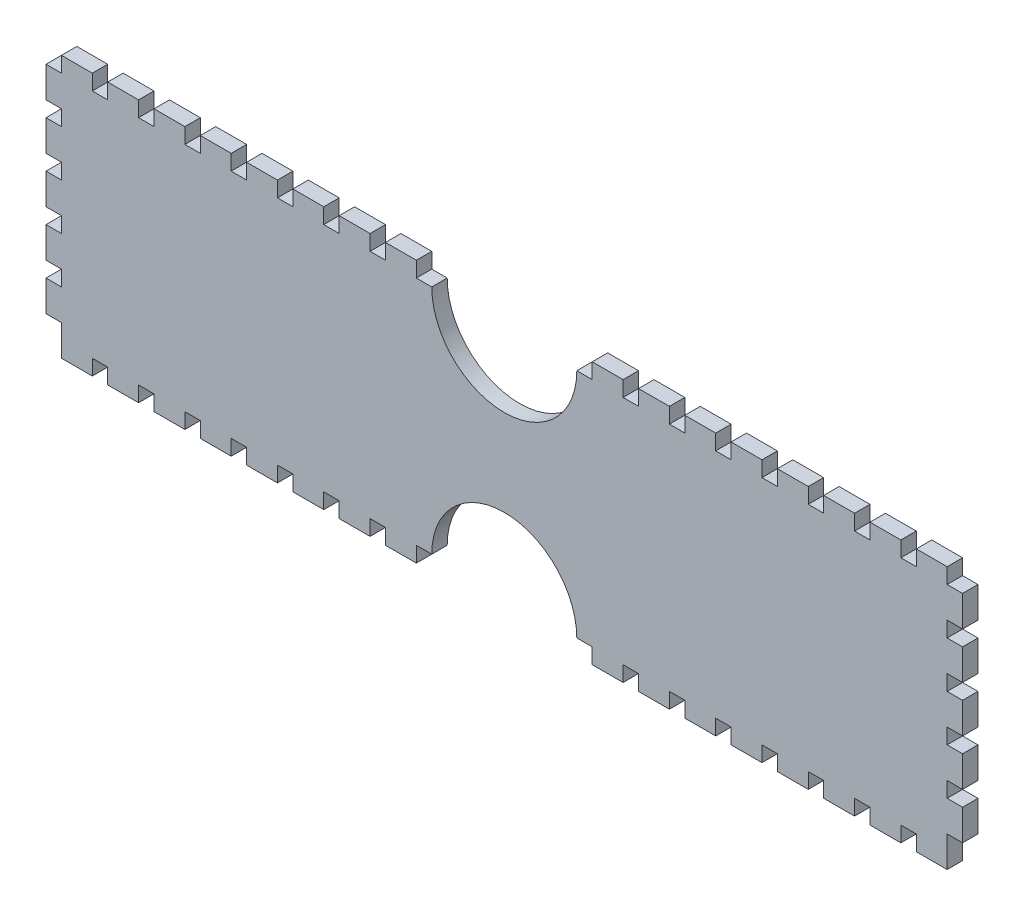
from build123d import *

# Parameters (mm, degrees)
ESQUISSE1_W                = 297
ESQUISSE1_H                = 85
BOSS_EXTRU_1_DEPTH         = 5
ENL_V_MAT_EXTRU_2_REACH    = 179.089
ESQUISSE4_W                = 5
ESQUISSE4_H                = 5
R_P_TITION_LIN_AIRE1_COUNT = 6
R_P_TITION_LIN_AIRE1_PITCH = 15
ESQUISSE5_W                = 5
ESQUISSE5_H                = 5
ENL_V_MAT_EXTRU_3_DEPTH    = 5
ESQUISSE6_W                = 5
ESQUISSE6_H                = 5
ENL_V_MAT_EXTRU_4_DEPTH    = 5
R_P_TITION_LIN_AIRE5_COUNT = 6
R_P_TITION_LIN_AIRE5_PITCH = 15
ESQUISSE8_W                = 5
ESQUISSE8_H                = 5
ENL_V_MAT_EXTRU_5_DEPTH    = 5
ESQUISSE9_W                = 5
ESQUISSE9_H                = 5
ENL_V_MAT_EXTRU_6_DEPTH    = 5
R_P_TITION_LIN_AIRE7_COUNT = 8
R_P_TITION_LIN_AIRE7_PITCH = 15
SYM_TRIE5_COPY_1_SKETCH_W  = 5
SYM_TRIE5_COPY_1_SKETCH_H  = 5
SYM_TRIE5_COPY_1_DEPTH     = 5
SYM_TRIE5_COPY_2_SKETCH_W  = 5
SYM_TRIE5_COPY_2_SKETCH_H  = 5
SYM_TRIE5_COPY_2_DEPTH     = 5
SYM_TRIE5_COPY_3_SKETCH_W  = 5
SYM_TRIE5_COPY_3_SKETCH_H  = 5
SYM_TRIE5_COPY_3_DEPTH     = 5
SYM_TRIE5_COPY_4_SKETCH_W  = 5
SYM_TRIE5_COPY_4_SKETCH_H  = 5
SYM_TRIE5_COPY_4_DEPTH     = 5
SYM_TRIE5_COPY_5_SKETCH_W  = 5
SYM_TRIE5_COPY_5_SKETCH_H  = 5
SYM_TRIE5_COPY_5_DEPTH     = 5
SYM_TRIE5_COPY_6_SKETCH_W  = 5
SYM_TRIE5_COPY_6_SKETCH_H  = 5
SYM_TRIE5_COPY_6_DEPTH     = 5
SYM_TRIE5_COPY_7_SKETCH_W  = 5
SYM_TRIE5_COPY_7_SKETCH_H  = 5
SYM_TRIE5_COPY_7_DEPTH     = 5
ESQUISSE11_W               = 47
ESQUISSE11_H               = 5
ENL_V_MAT_EXTRU_7_DEPTH    = 5
ESQUISSE12_W               = 47
ESQUISSE12_H               = 48.712218394
ENL_V_MAT_EXTRU_8_DEPTH    = 10
SYM_TRIE6_COPY_1_SKETCH_W  = 5
SYM_TRIE6_COPY_1_SKETCH_H  = 5
SYM_TRIE6_COPY_1_DEPTH     = 5
SYM_TRIE6_COPY_2_SKETCH_W  = 5
SYM_TRIE6_COPY_2_SKETCH_H  = 5
SYM_TRIE6_COPY_2_DEPTH     = 5
SYM_TRIE6_COPY_3_SKETCH_W  = 5
SYM_TRIE6_COPY_3_SKETCH_H  = 5
SYM_TRIE6_COPY_3_DEPTH     = 5
SYM_TRIE6_COPY_4_SKETCH_W  = 5
SYM_TRIE6_COPY_4_SKETCH_H  = 5
SYM_TRIE6_COPY_4_DEPTH     = 5
SYM_TRIE6_COPY_5_SKETCH_W  = 5
SYM_TRIE6_COPY_5_SKETCH_H  = 5
SYM_TRIE6_COPY_5_DEPTH     = 5
SYM_TRIE6_COPY_6_SKETCH_W  = 5
SYM_TRIE6_COPY_6_SKETCH_H  = 5
SYM_TRIE6_COPY_6_DEPTH     = 5
SYM_TRIE6_COPY_7_SKETCH_W  = 5
SYM_TRIE6_COPY_7_SKETCH_H  = 5
SYM_TRIE6_COPY_7_DEPTH     = 5
SYM_TRIE6_COPY_8_SKETCH_W  = 5
SYM_TRIE6_COPY_8_SKETCH_H  = 5
SYM_TRIE6_COPY_8_DEPTH     = 5
SYM_TRIE6_COPY_9_SKETCH_W  = 5
SYM_TRIE6_COPY_9_SKETCH_H  = 5
SYM_TRIE6_COPY_9_DEPTH     = 5
SYM_TRIE6_COPY_10_SKETCH_W = 5
SYM_TRIE6_COPY_10_SKETCH_H = 5
SYM_TRIE6_COPY_10_DEPTH    = 5
SYM_TRIE6_COPY_11_SKETCH_W = 5
SYM_TRIE6_COPY_11_SKETCH_H = 5
SYM_TRIE6_COPY_11_DEPTH    = 5
SYM_TRIE6_COPY_12_SKETCH_W = 5
SYM_TRIE6_COPY_12_SKETCH_H = 5
SYM_TRIE6_COPY_12_DEPTH    = 5
SYM_TRIE6_COPY_13_SKETCH_W = 5
SYM_TRIE6_COPY_13_SKETCH_H = 5
SYM_TRIE6_COPY_13_DEPTH    = 5
SYM_TRIE6_COPY_14_SKETCH_W = 5
SYM_TRIE6_COPY_14_SKETCH_H = 5
SYM_TRIE6_COPY_14_DEPTH    = 5
SYM_TRIE6_COPY_15_SKETCH_W = 5
SYM_TRIE6_COPY_15_SKETCH_H = 5
SYM_TRIE6_COPY_15_DEPTH    = 5


with BuildPart() as part:
    # Esquisse1 → Boss.-Extru.1 (new body)
    with BuildSketch(Plane.XY):
        with Locations((-16.405729948, 21.856109197)):
            Rectangle(ESQUISSE1_W, ESQUISSE1_H)
    extrude(amount=BOSS_EXTRU_1_DEPTH)

    # Esquisse4 → Enlèv. mat.-Extru.2 (cut, up to next)
    with BuildSketch(Plane.XY.offset(5), mode=Mode.PRIVATE) as enl_v_mat_extru_2_sk1:
        with Locations((-162.405729948, 61.856109197)):
            Rectangle(ESQUISSE4_W, ESQUISSE4_H)
    enl_v_mat_extru_2_tool1 = extrude(enl_v_mat_extru_2_sk1.sketch, amount=-ENL_V_MAT_EXTRU_2_REACH, mode=Mode.PRIVATE) & part.part
    enl_v_mat_extru_2 = enl_v_mat_extru_2_tool1.solids().sort_by_distance((-162.40573, 61.856109, 5))[0]
    add(enl_v_mat_extru_2, mode=Mode.SUBTRACT)

    # Répétition linéaire1: Enlèv. mat.-Extru.2 ×6
    with Locations(*[(0, -i * R_P_TITION_LIN_AIRE1_PITCH, 0) for i in range(1, R_P_TITION_LIN_AIRE1_COUNT)]):
        add(enl_v_mat_extru_2, mode=Mode.SUBTRACT)

    # Esquisse5 → Enlèv. mat.-Extru.3 (cut)
    with BuildSketch(Plane.XY.offset(5)):
        with Locations((-162.405729948, -18.143890803)):
            Rectangle(ESQUISSE5_W, ESQUISSE5_H)
    extrude(amount=-ENL_V_MAT_EXTRU_3_DEPTH, mode=Mode.SUBTRACT)

    # Esquisse6 → Enlèv. mat.-Extru.4 (cut)
    with BuildSketch(Plane.XY.offset(5)):
        with Locations((129.594270052, 61.856109197)):
            Rectangle(ESQUISSE6_W, ESQUISSE6_H)
    enl_v_mat_extru_4 = extrude(amount=-ENL_V_MAT_EXTRU_4_DEPTH, mode=Mode.SUBTRACT)

    # Répétition linéaire5: Enlèv. mat.-Extru.4 ×6
    with Locations(*[(0, -i * R_P_TITION_LIN_AIRE5_PITCH, 0) for i in range(1, R_P_TITION_LIN_AIRE5_COUNT)]):
        add(enl_v_mat_extru_4, mode=Mode.SUBTRACT)

    # Esquisse8 → Enlèv. mat.-Extru.5 (cut)
    with BuildSketch(Plane.XY.offset(5)):
        with Locations((129.594270052, -18.143890803)):
            Rectangle(ESQUISSE8_W, ESQUISSE8_H)
    extrude(amount=-ENL_V_MAT_EXTRU_5_DEPTH, mode=Mode.SUBTRACT)

    # Esquisse9 → Enlèv. mat.-Extru.6 (cut)
    with BuildSketch(Plane.XY.offset(5)):
        with Locations((-147.405729948, -18.143890803)):
            Rectangle(ESQUISSE9_W, ESQUISSE9_H)
    enl_v_mat_extru_6 = extrude(amount=-ENL_V_MAT_EXTRU_6_DEPTH, mode=Mode.SUBTRACT)

    # Répétition linéaire7: Enlèv. mat.-Extru.6 ×8
    with Locations(*[(i * R_P_TITION_LIN_AIRE7_PITCH, 0, 0) for i in range(1, R_P_TITION_LIN_AIRE7_COUNT)]):
        add(enl_v_mat_extru_6, mode=Mode.SUBTRACT)

    # Symétrie5: Enlèv. mat.-Extru.6 across plane
    add(enl_v_mat_extru_6.mirror(Plane.ZY.offset(16.405729948)), mode=Mode.SUBTRACT)

    # Symétrie5 copy 1 sketch → Symétrie5 copy 1 (cut)
    with BuildSketch(Plane(origin=(-47.811459896, 0, 5), x_dir=(-1, 0, 0), z_dir=(0, 0, 1))):
        with Locations((-147.405729948, 18.143890803)):
            Rectangle(SYM_TRIE5_COPY_1_SKETCH_W, SYM_TRIE5_COPY_1_SKETCH_H)
    extrude(amount=-SYM_TRIE5_COPY_1_DEPTH, mode=Mode.SUBTRACT)

    # Symétrie5 copy 2 sketch → Symétrie5 copy 2 (cut)
    with BuildSketch(Plane(origin=(-62.811459896, 0, 5), x_dir=(-1, 0, 0), z_dir=(0, 0, 1))):
        with Locations((-147.405729948, 18.143890803)):
            Rectangle(SYM_TRIE5_COPY_2_SKETCH_W, SYM_TRIE5_COPY_2_SKETCH_H)
    extrude(amount=-SYM_TRIE5_COPY_2_DEPTH, mode=Mode.SUBTRACT)

    # Symétrie5 copy 3 sketch → Symétrie5 copy 3 (cut)
    with BuildSketch(Plane(origin=(-77.811459896, 0, 5), x_dir=(-1, 0, 0), z_dir=(0, 0, 1))):
        with Locations((-147.405729948, 18.143890803)):
            Rectangle(SYM_TRIE5_COPY_3_SKETCH_W, SYM_TRIE5_COPY_3_SKETCH_H)
    extrude(amount=-SYM_TRIE5_COPY_3_DEPTH, mode=Mode.SUBTRACT)

    # Symétrie5 copy 4 sketch → Symétrie5 copy 4 (cut)
    with BuildSketch(Plane(origin=(-92.811459896, 0, 5), x_dir=(-1, 0, 0), z_dir=(0, 0, 1))):
        with Locations((-147.405729948, 18.143890803)):
            Rectangle(SYM_TRIE5_COPY_4_SKETCH_W, SYM_TRIE5_COPY_4_SKETCH_H)
    extrude(amount=-SYM_TRIE5_COPY_4_DEPTH, mode=Mode.SUBTRACT)

    # Symétrie5 copy 5 sketch → Symétrie5 copy 5 (cut)
    with BuildSketch(Plane(origin=(-107.811459896, 0, 5), x_dir=(-1, 0, 0), z_dir=(0, 0, 1))):
        with Locations((-147.405729948, 18.143890803)):
            Rectangle(SYM_TRIE5_COPY_5_SKETCH_W, SYM_TRIE5_COPY_5_SKETCH_H)
    extrude(amount=-SYM_TRIE5_COPY_5_DEPTH, mode=Mode.SUBTRACT)

    # Symétrie5 copy 6 sketch → Symétrie5 copy 6 (cut)
    with BuildSketch(Plane(origin=(-122.811459896, 0, 5), x_dir=(-1, 0, 0), z_dir=(0, 0, 1))):
        with Locations((-147.405729948, 18.143890803)):
            Rectangle(SYM_TRIE5_COPY_6_SKETCH_W, SYM_TRIE5_COPY_6_SKETCH_H)
    extrude(amount=-SYM_TRIE5_COPY_6_DEPTH, mode=Mode.SUBTRACT)

    # Symétrie5 copy 7 sketch → Symétrie5 copy 7 (cut)
    with BuildSketch(Plane(origin=(-137.811459896, 0, 5), x_dir=(-1, 0, 0), z_dir=(0, 0, 1))):
        with Locations((-147.405729948, 18.143890803)):
            Rectangle(SYM_TRIE5_COPY_7_SKETCH_W, SYM_TRIE5_COPY_7_SKETCH_H)
    extrude(amount=-SYM_TRIE5_COPY_7_DEPTH, mode=Mode.SUBTRACT)

    # Esquisse11 → Enlèv. mat.-Extru.7 (cut)
    with BuildSketch(Plane.XY.offset(5)):
        with BuildLine():
            ThreePointArc((7.094270052, 59.356109197), (-16.405729948, 35.856109197), (-39.905729948, 59.356109197))
            Line((-39.905729948, 59.356109197), (7.094270052, 59.356109197))
        make_face()
        with Locations((-16.405729948, 61.856109197)):
            Rectangle(ESQUISSE11_W, ESQUISSE11_H)
    extrude(amount=-ENL_V_MAT_EXTRU_7_DEPTH, mode=Mode.SUBTRACT)

    # Esquisse12 → Enlèv. mat.-Extru.8 (cut)
    with BuildSketch(Plane.XY.offset(5)):
        with Locations((-16.405729948, -40)):
            Rectangle(ESQUISSE12_W, ESQUISSE12_H)
        with BuildLine():
            ThreePointArc((-39.905729948, -15.643890803), (-16.405729948, 7.856109197), (7.094270052, -15.643890803))
            Line((7.094270052, -15.643890803), (-39.905729948, -15.643890803))
        make_face()
    extrude(amount=-ENL_V_MAT_EXTRU_8_DEPTH, mode=Mode.SUBTRACT)

    # Symétrie6: Enlèv. mat.-Extru.6 across plane
    add(enl_v_mat_extru_6.mirror(Plane.ZX.offset(21.856109197)), mode=Mode.SUBTRACT)

    # Symétrie6 copy 1 sketch → Symétrie6 copy 1 (cut)
    with BuildSketch(Plane(origin=(15, 43.712218393, 5), x_dir=(1, 0, 0), z_dir=(0, 0, 1))):
        with Locations((-147.405729948, 18.143890803)):
            Rectangle(SYM_TRIE6_COPY_1_SKETCH_W, SYM_TRIE6_COPY_1_SKETCH_H)
    extrude(amount=-SYM_TRIE6_COPY_1_DEPTH, mode=Mode.SUBTRACT)

    # Symétrie6 copy 2 sketch → Symétrie6 copy 2 (cut)
    with BuildSketch(Plane(origin=(30, 43.712218393, 5), x_dir=(1, 0, 0), z_dir=(0, 0, 1))):
        with Locations((-147.405729948, 18.143890803)):
            Rectangle(SYM_TRIE6_COPY_2_SKETCH_W, SYM_TRIE6_COPY_2_SKETCH_H)
    extrude(amount=-SYM_TRIE6_COPY_2_DEPTH, mode=Mode.SUBTRACT)

    # Symétrie6 copy 3 sketch → Symétrie6 copy 3 (cut)
    with BuildSketch(Plane(origin=(45, 43.712218393, 5), x_dir=(1, 0, 0), z_dir=(0, 0, 1))):
        with Locations((-147.405729948, 18.143890803)):
            Rectangle(SYM_TRIE6_COPY_3_SKETCH_W, SYM_TRIE6_COPY_3_SKETCH_H)
    extrude(amount=-SYM_TRIE6_COPY_3_DEPTH, mode=Mode.SUBTRACT)

    # Symétrie6 copy 4 sketch → Symétrie6 copy 4 (cut)
    with BuildSketch(Plane(origin=(60, 43.712218393, 5), x_dir=(1, 0, 0), z_dir=(0, 0, 1))):
        with Locations((-147.405729948, 18.143890803)):
            Rectangle(SYM_TRIE6_COPY_4_SKETCH_W, SYM_TRIE6_COPY_4_SKETCH_H)
    extrude(amount=-SYM_TRIE6_COPY_4_DEPTH, mode=Mode.SUBTRACT)

    # Symétrie6 copy 5 sketch → Symétrie6 copy 5 (cut)
    with BuildSketch(Plane(origin=(75, 43.712218393, 5), x_dir=(1, 0, 0), z_dir=(0, 0, 1))):
        with Locations((-147.405729948, 18.143890803)):
            Rectangle(SYM_TRIE6_COPY_5_SKETCH_W, SYM_TRIE6_COPY_5_SKETCH_H)
    extrude(amount=-SYM_TRIE6_COPY_5_DEPTH, mode=Mode.SUBTRACT)

    # Symétrie6 copy 6 sketch → Symétrie6 copy 6 (cut)
    with BuildSketch(Plane(origin=(90, 43.712218393, 5), x_dir=(1, 0, 0), z_dir=(0, 0, 1))):
        with Locations((-147.405729948, 18.143890803)):
            Rectangle(SYM_TRIE6_COPY_6_SKETCH_W, SYM_TRIE6_COPY_6_SKETCH_H)
    extrude(amount=-SYM_TRIE6_COPY_6_DEPTH, mode=Mode.SUBTRACT)

    # Symétrie6 copy 7 sketch → Symétrie6 copy 7 (cut)
    with BuildSketch(Plane(origin=(105, 43.712218393, 5), x_dir=(1, 0, 0), z_dir=(0, 0, 1))):
        with Locations((-147.405729948, 18.143890803)):
            Rectangle(SYM_TRIE6_COPY_7_SKETCH_W, SYM_TRIE6_COPY_7_SKETCH_H)
    extrude(amount=-SYM_TRIE6_COPY_7_DEPTH, mode=Mode.SUBTRACT)

    # Symétrie6 copy 8 sketch → Symétrie6 copy 8 (cut)
    with BuildSketch(Plane(origin=(-32.811459896, 43.712218393, 5), x_dir=(-1, 0, 0), z_dir=(0, 0, 1))):
        with Locations((-147.405729948, -18.143890803)):
            Rectangle(SYM_TRIE6_COPY_8_SKETCH_W, SYM_TRIE6_COPY_8_SKETCH_H)
    extrude(amount=-SYM_TRIE6_COPY_8_DEPTH, mode=Mode.SUBTRACT)

    # Symétrie6 copy 9 sketch → Symétrie6 copy 9 (cut)
    with BuildSketch(Plane(origin=(-47.811459896, 43.712218393, 5), x_dir=(-1, 0, 0), z_dir=(0, 0, 1))):
        with Locations((-147.405729948, -18.143890803)):
            Rectangle(SYM_TRIE6_COPY_9_SKETCH_W, SYM_TRIE6_COPY_9_SKETCH_H)
    extrude(amount=-SYM_TRIE6_COPY_9_DEPTH, mode=Mode.SUBTRACT)

    # Symétrie6 copy 10 sketch → Symétrie6 copy 10 (cut)
    with BuildSketch(Plane(origin=(-62.811459896, 43.712218393, 5), x_dir=(-1, 0, 0), z_dir=(0, 0, 1))):
        with Locations((-147.405729948, -18.143890803)):
            Rectangle(SYM_TRIE6_COPY_10_SKETCH_W, SYM_TRIE6_COPY_10_SKETCH_H)
    extrude(amount=-SYM_TRIE6_COPY_10_DEPTH, mode=Mode.SUBTRACT)

    # Symétrie6 copy 11 sketch → Symétrie6 copy 11 (cut)
    with BuildSketch(Plane(origin=(-77.811459896, 43.712218393, 5), x_dir=(-1, 0, 0), z_dir=(0, 0, 1))):
        with Locations((-147.405729948, -18.143890803)):
            Rectangle(SYM_TRIE6_COPY_11_SKETCH_W, SYM_TRIE6_COPY_11_SKETCH_H)
    extrude(amount=-SYM_TRIE6_COPY_11_DEPTH, mode=Mode.SUBTRACT)

    # Symétrie6 copy 12 sketch → Symétrie6 copy 12 (cut)
    with BuildSketch(Plane(origin=(-92.811459896, 43.712218393, 5), x_dir=(-1, 0, 0), z_dir=(0, 0, 1))):
        with Locations((-147.405729948, -18.143890803)):
            Rectangle(SYM_TRIE6_COPY_12_SKETCH_W, SYM_TRIE6_COPY_12_SKETCH_H)
    extrude(amount=-SYM_TRIE6_COPY_12_DEPTH, mode=Mode.SUBTRACT)

    # Symétrie6 copy 13 sketch → Symétrie6 copy 13 (cut)
    with BuildSketch(Plane(origin=(-107.811459896, 43.712218393, 5), x_dir=(-1, 0, 0), z_dir=(0, 0, 1))):
        with Locations((-147.405729948, -18.143890803)):
            Rectangle(SYM_TRIE6_COPY_13_SKETCH_W, SYM_TRIE6_COPY_13_SKETCH_H)
    extrude(amount=-SYM_TRIE6_COPY_13_DEPTH, mode=Mode.SUBTRACT)

    # Symétrie6 copy 14 sketch → Symétrie6 copy 14 (cut)
    with BuildSketch(Plane(origin=(-122.811459896, 43.712218393, 5), x_dir=(-1, 0, 0), z_dir=(0, 0, 1))):
        with Locations((-147.405729948, -18.143890803)):
            Rectangle(SYM_TRIE6_COPY_14_SKETCH_W, SYM_TRIE6_COPY_14_SKETCH_H)
    extrude(amount=-SYM_TRIE6_COPY_14_DEPTH, mode=Mode.SUBTRACT)

    # Symétrie6 copy 15 sketch → Symétrie6 copy 15 (cut)
    with BuildSketch(Plane(origin=(-137.811459896, 43.712218393, 5), x_dir=(-1, 0, 0), z_dir=(0, 0, 1))):
        with Locations((-147.405729948, -18.143890803)):
            Rectangle(SYM_TRIE6_COPY_15_SKETCH_W, SYM_TRIE6_COPY_15_SKETCH_H)
    extrude(amount=-SYM_TRIE6_COPY_15_DEPTH, mode=Mode.SUBTRACT)


solid = part.part
